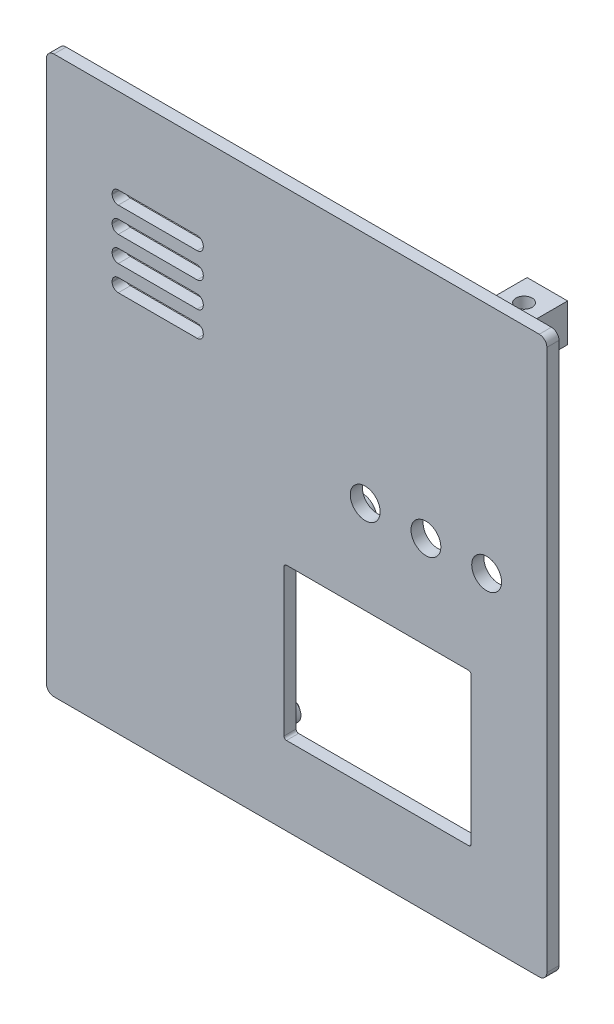
from build123d import *

# Parameters (mm, degrees)
LID_PLATE_START                        = 37.6
LID_PLATE_DEPTH                        = 2.4
TWO_SIDE_FASTENING_TABS_START          = 29
SKETCH_2_W                             = 8
SKETCH_2_H                             = 7.5
TWO_SIDE_FASTENING_TABS_DEPTH          = 8.6
M3_TAB_BORE_1_DEPTH                    = 3.8
M3_TAB_BORE_1_DEPTH_BACK               = 3.8
M3_TAB_BORE_1_START                    = -3.25
SKETCH_3_R                             = 1.6
M3_TAB_CAPTIVE_NUT_1_DEPTH             = 1.3
M3_TAB_CAPTIVE_NUT_1_DEPTH_BACK        = 1.3
M3_TAB_CAPTIVE_NUT_1_START             = -3.3
M3_TAB_NUT_LOADING_SLOT_1_DEPTH        = 1.3
M3_TAB_NUT_LOADING_SLOT_1_DEPTH_BACK   = 1.3
M3_TAB_NUT_LOADING_SLOT_1_START        = -3.3
SKETCH_5_W                             = 4.3
SKETCH_5_H                             = 6.7
M3_TAB_BORE_2_DEPTH                    = 3.8
M3_TAB_BORE_2_DEPTH_BACK               = 3.8
M3_TAB_BORE_2_START                    = 94.25
SKETCH_6_R                             = 1.6
M3_TAB_CAPTIVE_NUT_2_DEPTH             = 1.3
M3_TAB_CAPTIVE_NUT_2_DEPTH_BACK        = 1.3
M3_TAB_CAPTIVE_NUT_2_START             = 94.3
M3_TAB_NUT_LOADING_SLOT_2_DEPTH        = 1.3
M3_TAB_NUT_LOADING_SLOT_2_DEPTH_BACK   = 1.3
M3_TAB_NUT_LOADING_SLOT_2_START        = 94.3
SKETCH_8_W                             = 4.3
SKETCH_8_H                             = 6.7
SIDE_LOCATING_LIPS_START               = 35.6
SKETCH_9_W                             = 62
SKETCH_9_H                             = 1.2
SIDE_LOCATING_LIPS_DEPTH               = 2
LCD_VIEWING_WINDOW_DEPTH               = 144.896699059
LCD_VIEWING_WINDOW_DEPTH_BACK          = 144.896699059
LCD_MOUNTING_SPACERS_START             = 34.3
SKETCH_11_R                            = 2.1
LCD_MOUNTING_SPACERS_DEPTH             = 3.3
TWO_LCD_LOCATING_PINS_START            = 33.3
SKETCH_12_R                            = 0.8
TWO_LCD_LOCATING_PINS_DEPTH            = 1
TWO_BLIND_M1P6_LCD_PILOTS_DEPTH        = 1.45
TWO_BLIND_M1P6_LCD_PILOTS_DEPTH_BACK   = 1.45
TWO_BLIND_M1P6_LCD_PILOTS_START        = 35.75
SKETCH_13_R                            = 0.65
THREE_BUTTON_GUIDES_DEPTH              = 144.896699059
THREE_BUTTON_GUIDES_DEPTH_BACK         = 144.896699059
SKETCH_14_R                            = 2.95
BUTTON_RETAINER_BOSSES_START           = 35.6
SKETCH_15_R                            = 2.9
BUTTON_RETAINER_BOSSES_DEPTH           = 2
BUTTON_RETAINER_PILOT_HOLES_DEPTH      = 1.9
BUTTON_RETAINER_PILOT_HOLES_DEPTH_BACK = 1.9
BUTTON_RETAINER_PILOT_HOLES_START      = 37.5
SKETCH_16_R                            = 1.1
TOP_AIR_SLOTS_DEPTH                    = 144.896699059
TOP_AIR_SLOTS_DEPTH_BACK               = 144.896699059


with BuildPart() as part:
    # 草图1 → Lid_plate (new body)
    with BuildSketch(Plane.XY.offset(LID_PLATE_START)):
        with BuildLine():
            Line((-2.5, -9.5), (93.4, -9.5))
            ThreePointArc((93.4, -9.5), (94.460660172, -9.060660172), (94.9, -8))
            Line((94.9, -8), (94.9, 99))
            ThreePointArc((94.9, 99), (94.460660172, 100.060660172), (93.4, 100.5))
            Line((93.4, 100.5), (-2.5, 100.5))
            ThreePointArc((-2.5, 100.5), (-3.560660172, 100.060660172), (-4, 99))
            Line((-4, 99), (-4, -8))
            ThreePointArc((-4, -8), (-3.560660172, -9.060660172), (-2.5, -9.5))
        make_face()
    extrude(amount=LID_PLATE_DEPTH)

    # 草图2 → Two_side_fastening_tabs (add)
    with BuildSketch(Plane.XY.offset(TWO_SIDE_FASTENING_TABS_START)):
        with Locations((7, -3.25)):
            Rectangle(SKETCH_2_W, SKETCH_2_H)
        with Locations((84, 94.25)):
            Rectangle(SKETCH_2_W, SKETCH_2_H)
    extrude(amount=TWO_SIDE_FASTENING_TABS_DEPTH)

    # 草图3 → M3_tab_bore_1 (cut, two sides: drawn at the far end of the back side and taken through both)
    with BuildSketch(Plane(origin=(0, 0, 0), x_dir=(1, 0, 0), z_dir=(0, 1, 0)).offset(M3_TAB_BORE_1_START - M3_TAB_BORE_1_DEPTH_BACK)):
        with Locations(Location((7, -33.6, 0), (0, 0, 90))):
            Circle(SKETCH_3_R)
    extrude(amount=M3_TAB_BORE_1_DEPTH + M3_TAB_BORE_1_DEPTH_BACK, mode=Mode.SUBTRACT)

    # 草图4 → M3_tab_captive_nut_1 (cut, two sides: drawn at the far end of the back side and taken through both)
    with BuildSketch(Plane(origin=(0, 0, 0), x_dir=(1, 0, 0), z_dir=(0, 1, 0)).offset(M3_TAB_CAPTIVE_NUT_1_START - M3_TAB_CAPTIVE_NUT_1_DEPTH_BACK)):
        Polygon((9.875, -35.259882024), (7, -36.919764048), (4.125, -35.259882024), (4.125, -31.940117976), (7, -30.280235952), (9.875, -31.940117976), align=None)
    extrude(amount=M3_TAB_CAPTIVE_NUT_1_DEPTH + M3_TAB_CAPTIVE_NUT_1_DEPTH_BACK, mode=Mode.SUBTRACT)

    # 草图5 → M3_tab_nut_loading_slot_1 (cut, two sides: drawn at the far end of the back side and taken through both)
    with BuildSketch(Plane(origin=(0, 0, 0), x_dir=(1, 0, 0), z_dir=(0, 1, 0)).offset(M3_TAB_NUT_LOADING_SLOT_1_START - M3_TAB_NUT_LOADING_SLOT_1_DEPTH_BACK)):
        with Locations((9.15, -33.6)):
            Rectangle(SKETCH_5_W, SKETCH_5_H)
    extrude(amount=M3_TAB_NUT_LOADING_SLOT_1_DEPTH + M3_TAB_NUT_LOADING_SLOT_1_DEPTH_BACK, mode=Mode.SUBTRACT)

    # 草图6 → M3_tab_bore_2 (cut, two sides: drawn at the far end of the back side and taken through both)
    with BuildSketch(Plane(origin=(0, 0, 0), x_dir=(1, 0, 0), z_dir=(0, 1, 0)).offset(M3_TAB_BORE_2_START - M3_TAB_BORE_2_DEPTH_BACK)):
        with Locations(Location((84, -33.6, 0), (0, 0, 90))):
            Circle(SKETCH_6_R)
    extrude(amount=M3_TAB_BORE_2_DEPTH + M3_TAB_BORE_2_DEPTH_BACK, mode=Mode.SUBTRACT)

    # 草图7 → M3_tab_captive_nut_2 (cut, two sides: drawn at the far end of the back side and taken through both)
    with BuildSketch(Plane(origin=(0, 0, 0), x_dir=(1, 0, 0), z_dir=(0, 1, 0)).offset(M3_TAB_CAPTIVE_NUT_2_START - M3_TAB_CAPTIVE_NUT_2_DEPTH_BACK)):
        Polygon((86.875, -35.259882024), (84, -36.919764048), (81.125, -35.259882024), (81.125, -31.940117976), (84, -30.280235952), (86.875, -31.940117976), align=None)
    extrude(amount=M3_TAB_CAPTIVE_NUT_2_DEPTH + M3_TAB_CAPTIVE_NUT_2_DEPTH_BACK, mode=Mode.SUBTRACT)

    # 草图8 → M3_tab_nut_loading_slot_2 (cut, two sides: drawn at the far end of the back side and taken through both)
    with BuildSketch(Plane(origin=(0, 0, 0), x_dir=(1, 0, 0), z_dir=(0, 1, 0)).offset(M3_TAB_NUT_LOADING_SLOT_2_START - M3_TAB_NUT_LOADING_SLOT_2_DEPTH_BACK)):
        with Locations((81.85, -33.6)):
            Rectangle(SKETCH_8_W, SKETCH_8_H)
    extrude(amount=M3_TAB_NUT_LOADING_SLOT_2_DEPTH + M3_TAB_NUT_LOADING_SLOT_2_DEPTH_BACK, mode=Mode.SUBTRACT)

    # 草图9 → Side_locating_lips (add)
    with BuildSketch(Plane.XY.offset(SIDE_LOCATING_LIPS_START)):
        with Locations((46, -6.2)):
            Rectangle(SKETCH_9_W, SKETCH_9_H)
        with Locations((46, 97.2)):
            Rectangle(SKETCH_9_W, SKETCH_9_H)
    extrude(amount=SIDE_LOCATING_LIPS_DEPTH)

    # 草图10 → LCD_viewing_window (cut, two sides: drawn at the far end of the back side and taken through both)
    with BuildSketch(Plane.XY.offset(-LCD_VIEWING_WINDOW_DEPTH_BACK)):
        with BuildLine():
            Line((43.44, 6), (79.44, 6))
            ThreePointArc((79.44, 6), (79.793553391, 6.146446609), (79.94, 6.5))
            Line((79.94, 6.5), (79.94, 35.5))
            ThreePointArc((79.94, 35.5), (79.793553391, 35.853553391), (79.44, 36))
            Line((79.44, 36), (43.44, 36))
            ThreePointArc((43.44, 36), (43.086446609, 35.853553391), (42.94, 35.5))
            Line((42.94, 35.5), (42.94, 6.5))
            ThreePointArc((42.94, 6.5), (43.086446609, 6.146446609), (43.44, 6))
        make_face()
    extrude(amount=LCD_VIEWING_WINDOW_DEPTH + LCD_VIEWING_WINDOW_DEPTH_BACK, mode=Mode.SUBTRACT)

    # 草图11 → LCD_mounting_spacers (add)
    with BuildSketch(Plane.XY.offset(LCD_MOUNTING_SPACERS_START)):
        with Locations(Location((38.5, 6, 0), (0, 0, 180))):
            Circle(SKETCH_11_R)
        with Locations(Location((38.5, 36, 0), (0, 0, 180))):
            Circle(SKETCH_11_R)
        with Locations(Location((89.5, 6, 0), (0, 0, 180))):
            Circle(SKETCH_11_R)
        with Locations(Location((89.5, 36, 0), (0, 0, 180))):
            Circle(SKETCH_11_R)
    extrude(amount=LCD_MOUNTING_SPACERS_DEPTH)

    # 草图12 → Two_LCD_locating_pins (add)
    with BuildSketch(Plane.XY.offset(TWO_LCD_LOCATING_PINS_START)):
        with Locations((38.5, 6)):
            Circle(SKETCH_12_R)
        with Locations((89.5, 36)):
            Circle(SKETCH_12_R)
    extrude(amount=TWO_LCD_LOCATING_PINS_DEPTH)

    # 草图13 → Two_blind_M1p6_LCD_pilots (cut, two sides: drawn at the far end of the back side and taken through both)
    with BuildSketch(Plane.XY.offset(TWO_BLIND_M1P6_LCD_PILOTS_START - TWO_BLIND_M1P6_LCD_PILOTS_DEPTH_BACK)):
        with Locations((38.5, 36)):
            Circle(SKETCH_13_R)
        with Locations((89.5, 6)):
            Circle(SKETCH_13_R)
    extrude(amount=TWO_BLIND_M1P6_LCD_PILOTS_DEPTH + TWO_BLIND_M1P6_LCD_PILOTS_DEPTH_BACK, mode=Mode.SUBTRACT)

    # 草图14 → Three_button_guides (cut, two sides: drawn at the far end of the back side and taken through both)
    with BuildSketch(Plane.XY.offset(-THREE_BUTTON_GUIDES_DEPTH_BACK)):
        with Locations(Location((59, 54.355, 0), (0, 0, 180))):
            Circle(SKETCH_14_R)
        with Locations(Location((71, 54.355, 0), (0, 0, 180))):
            Circle(SKETCH_14_R)
        with Locations(Location((83, 54.355, 0), (0, 0, 180))):
            Circle(SKETCH_14_R)
    extrude(amount=THREE_BUTTON_GUIDES_DEPTH + THREE_BUTTON_GUIDES_DEPTH_BACK, mode=Mode.SUBTRACT)

    # 草图15 → Button_retainer_bosses (add)
    with BuildSketch(Plane.XY.offset(BUTTON_RETAINER_BOSSES_START)):
        with Locations((54, 48.5)):
            Circle(SKETCH_15_R)
        with Locations((88, 60.2)):
            Circle(SKETCH_15_R)
    extrude(amount=BUTTON_RETAINER_BOSSES_DEPTH)

    # 草图16 → Button_retainer_pilot_holes (cut, two sides: drawn at the far end of the back side and taken through both)
    with BuildSketch(Plane.XY.offset(BUTTON_RETAINER_PILOT_HOLES_START - BUTTON_RETAINER_PILOT_HOLES_DEPTH_BACK)):
        with Locations(Location((54, 48.5, 0), (0, 0, 180))):
            Circle(SKETCH_16_R)
        with Locations(Location((88, 60.2, 0), (0, 0, 180))):
            Circle(SKETCH_16_R)
    extrude(amount=BUTTON_RETAINER_PILOT_HOLES_DEPTH + BUTTON_RETAINER_PILOT_HOLES_DEPTH_BACK, mode=Mode.SUBTRACT)

    # 草图17 → Top_air_slots (cut, two sides: drawn at the far end of the back side and taken through both)
    with BuildSketch(Plane.XY.offset(-TOP_AIR_SLOTS_DEPTH_BACK)):
        with BuildLine():
            Line((10.2, 66), (25.8, 66))
            ThreePointArc((25.8, 66), (26.648528137, 66.351471863), (27, 67.2))
            Line((27, 67.2), (27, 67.4))
            ThreePointArc((27, 67.4), (26.648528137, 68.248528137), (25.8, 68.6))
            Line((25.8, 68.6), (10.2, 68.6))
            ThreePointArc((10.2, 68.6), (9.351471863, 68.248528137), (9, 67.4))
            Line((9, 67.4), (9, 67.2))
            ThreePointArc((9, 67.2), (9.351471863, 66.351471863), (10.2, 66))
        make_face()
        with BuildLine():
            Line((10.2, 71), (25.8, 71))
            ThreePointArc((25.8, 71), (26.648528137, 71.351471863), (27, 72.2))
            Line((27, 72.2), (27, 72.4))
            ThreePointArc((27, 72.4), (26.648528137, 73.248528137), (25.8, 73.6))
            Line((25.8, 73.6), (10.2, 73.6))
            ThreePointArc((10.2, 73.6), (9.351471863, 73.248528137), (9, 72.4))
            Line((9, 72.4), (9, 72.2))
            ThreePointArc((9, 72.2), (9.351471863, 71.351471863), (10.2, 71))
        make_face()
        with BuildLine():
            Line((10.2, 76), (25.8, 76))
            ThreePointArc((25.8, 76), (26.648528137, 76.351471863), (27, 77.2))
            Line((27, 77.2), (27, 77.4))
            ThreePointArc((27, 77.4), (26.648528137, 78.248528137), (25.8, 78.6))
            Line((25.8, 78.6), (10.2, 78.6))
            ThreePointArc((10.2, 78.6), (9.351471863, 78.248528137), (9, 77.4))
            Line((9, 77.4), (9, 77.2))
            ThreePointArc((9, 77.2), (9.351471863, 76.351471863), (10.2, 76))
        make_face()
        with BuildLine():
            Line((10.2, 81), (25.8, 81))
            ThreePointArc((25.8, 81), (26.648528137, 81.351471863), (27, 82.2))
            Line((27, 82.2), (27, 82.4))
            ThreePointArc((27, 82.4), (26.648528137, 83.248528137), (25.8, 83.6))
            Line((25.8, 83.6), (10.2, 83.6))
            ThreePointArc((10.2, 83.6), (9.351471863, 83.248528137), (9, 82.4))
            Line((9, 82.4), (9, 82.2))
            ThreePointArc((9, 82.2), (9.351471863, 81.351471863), (10.2, 81))
        make_face()
    extrude(amount=TOP_AIR_SLOTS_DEPTH + TOP_AIR_SLOTS_DEPTH_BACK, mode=Mode.SUBTRACT)


solid = part.part
